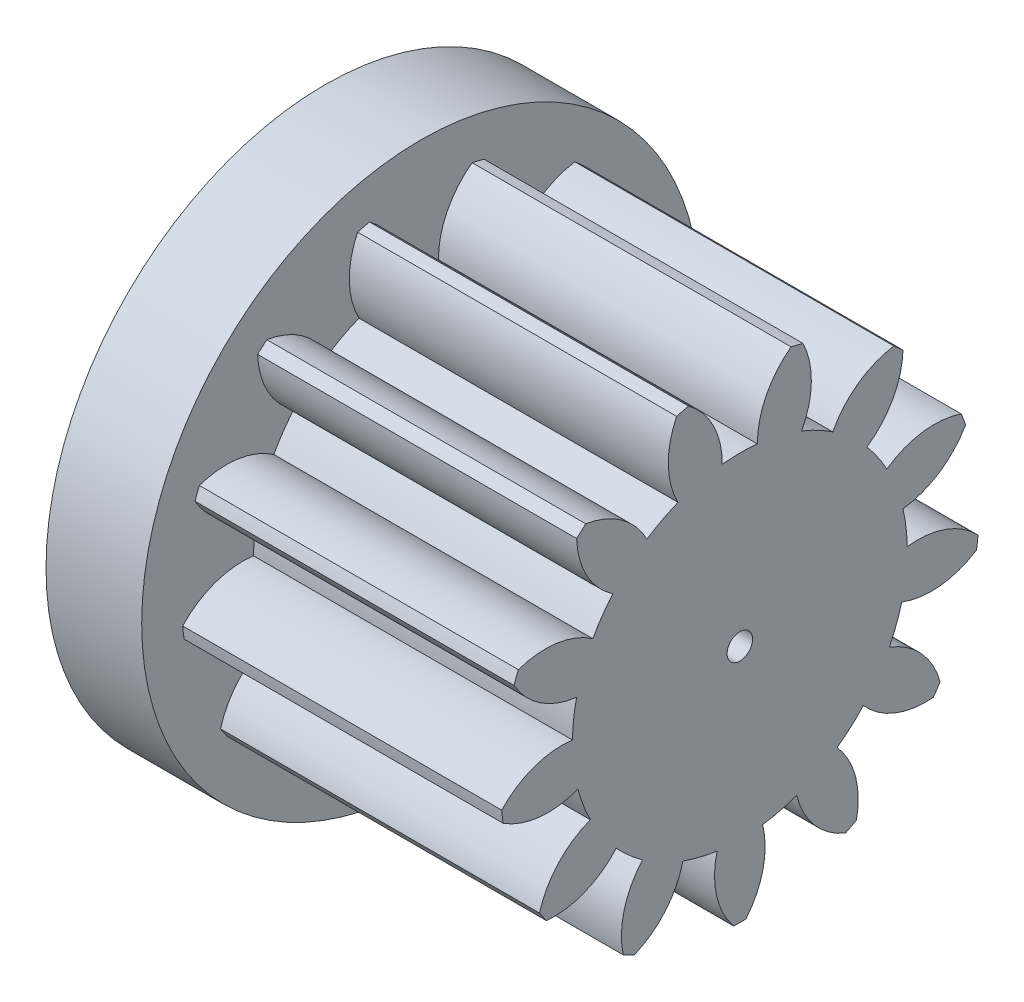
from build123d import *

# Parameters (mm, degrees)
BASPROSKE_W         = 10
BASPROSKE_H         = 7.5
TOOTHCUT_DEPTH      = 15.577379737
TEETHCUTS_COUNT     = 13
TEETHCUTS_ANGLE     = 332.307692308
BORSKE_R            = 0.4
BORE_DEPTH          = 50.0000508
SKETCH1_R           = 8.75
BOSS_EXTRUDE1_DEPTH = 3
SKETCH6_R           = 0.5
CUT_EXTRUDE1_DEPTH  = 2
CIRPATTERN1_COUNT   = 6


with BuildPart() as part:
    # BasProSke → Base-Revolve (revolve)
    with BuildSketch(Plane(origin=(0, 0, 0), x_dir=(1, 0, 0), z_dir=(0, 1, 0)), mode=Mode.PRIVATE) as base_revolve_sk:
        with Locations((5, 3.75)):
            Rectangle(BASPROSKE_W, BASPROSKE_H)
    revolve(base_revolve_sk.sketch.rotate(Axis((-10, 0, 0), (1, 0, 0)), 180), axis=Axis((-10, 0, 0), (1, 0, 0)))

    # TooCutSke → ToothCut (cut, through all)
    with BuildSketch(Plane(origin=(0, 0, 0), x_dir=(0, 0, -1), z_dir=(1, 0, 0))):
        with BuildLine():
            ThreePointArc((0.550489643, 5.220053846), (0, 5.249), (-0.550489643, 5.220053846))
            ThreePointArc((-0.550489643, 5.220053846), (-0.834571714, 6.414617604), (-1.635166801, 7.345602405))
            ThreePointArc((-1.635166801, 7.345602405), (0, 7.5254), (1.635166801, 7.345602405))
            ThreePointArc((1.635166801, 7.345602405), (0.834571714, 6.414617604), (0.550489643, 5.220053846))
        make_face()
    toothcut = extrude(amount=TOOTHCUT_DEPTH, mode=Mode.SUBTRACT)

    # TeethCuts: ToothCut ×13 about axis
    teethcuts_axis = Axis((-10, 0, 0), (1, 0, 0))
    for i in range(1, TEETHCUTS_COUNT):
        add(toothcut.rotate(teethcuts_axis, i * TEETHCUTS_ANGLE / (TEETHCUTS_COUNT - 1)), mode=Mode.SUBTRACT)

    # BorSke → Bore (cut, symmetric)
    with BuildSketch(Plane(origin=(0, 0, 0), x_dir=(0, 0, -1), z_dir=(1, 0, 0))):
        with Locations(Location((0, 0, 0), (0, 0, 180))):
            Circle(BORSKE_R)
    extrude(amount=BORE_DEPTH, both=True, mode=Mode.SUBTRACT)

    # Sketch1 → Boss-Extrude1 (add)
    with BuildSketch(Plane.ZY):
        Circle(SKETCH1_R)
    extrude(amount=BOSS_EXTRUDE1_DEPTH)

    # Sketch6 → Cut-Extrude1 (cut)
    with BuildSketch(Plane.ZY.offset(3)):
        with Locations((-8.01665008, -1.724332186)):
            Circle(SKETCH6_R)
    cut_extrude1 = extrude(amount=-CUT_EXTRUDE1_DEPTH, mode=Mode.SUBTRACT)

    # CirPattern1: Cut-Extrude1 ×6 about axis
    cirpattern1_axis = Axis((0, 0, 0), (1, 0, 0))
    for i in range(1, CIRPATTERN1_COUNT):
        add(cut_extrude1.rotate(cirpattern1_axis, i * 360 / CIRPATTERN1_COUNT), mode=Mode.SUBTRACT)


solid = part.part
